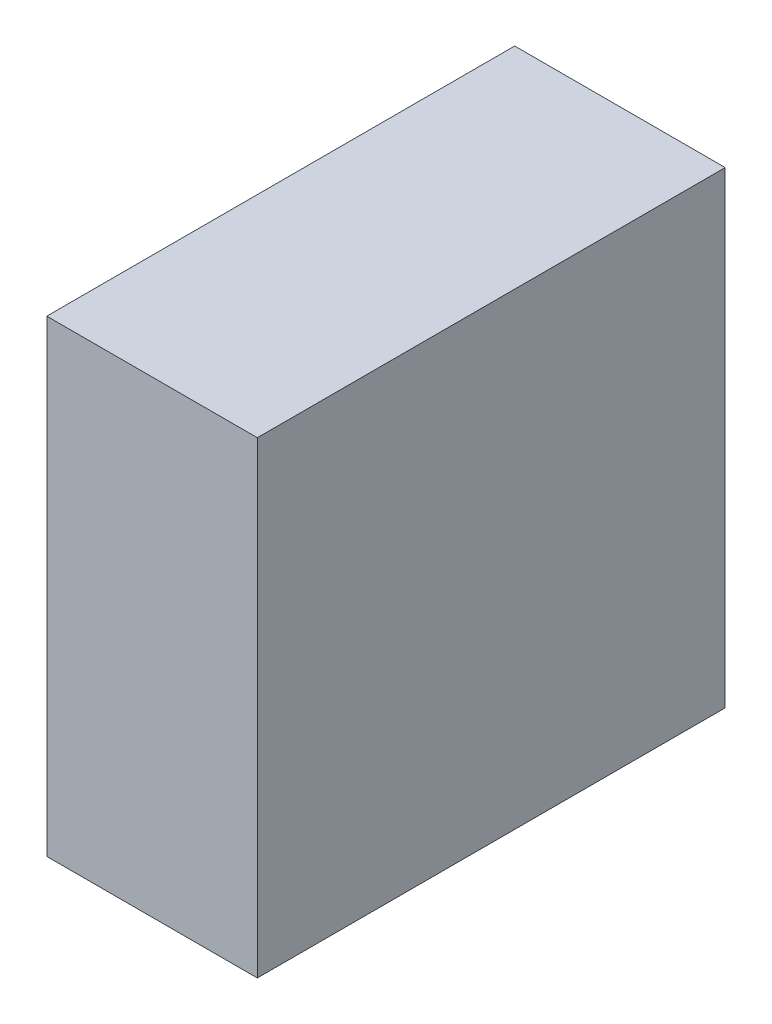
from build123d import *

# Parameters (mm, degrees)
PACK_PANO_MOTOR_SURUCU_1_1_START = -148
SKETCH1_W                        = 45
SKETCH1_H                        = 100
PACK_PANO_MOTOR_SURUCU_1_1_DEPTH = 100


with BuildPart() as part:
    # Sketch1 → PACK_pano_motor_surucu_1_1 (new body)
    with BuildSketch(Plane.XY.offset(PACK_PANO_MOTOR_SURUCU_1_1_START)):
        with Locations((412.5, 230)):
            Rectangle(SKETCH1_W, SKETCH1_H)
    extrude(amount=-PACK_PANO_MOTOR_SURUCU_1_1_DEPTH)


solid = part.part
